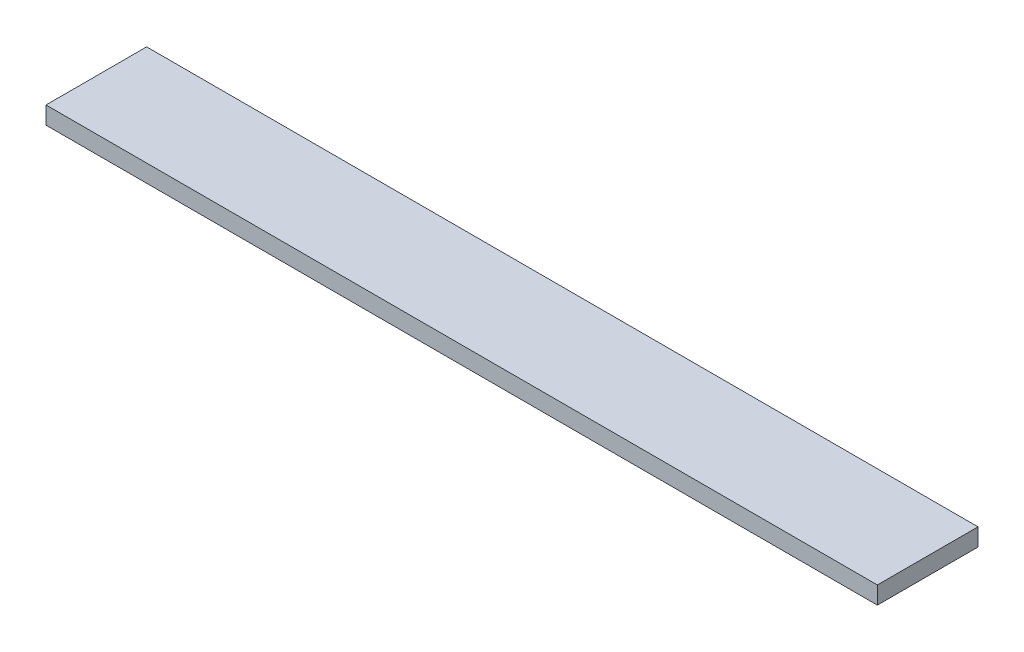
from build123d import *

# Parameters (mm, degrees)
SKETCH1_W           = 4826
SKETCH1_H           = 1168.4
BOSS_EXTRUDE1_DEPTH = 101.6
SKETCH2_W           = 4826
SKETCH2_H           = 584.2
CUT_EXTRUDE1_DEPTH  = 2485.789971004


with BuildPart() as part:
    # Sketch1 → Boss-Extrude1 (new body)
    with BuildSketch(Plane(origin=(0, 0, 0), x_dir=(1, 0, 0), z_dir=(0, 1, 0))):
        Rectangle(SKETCH1_W, SKETCH1_H)
    extrude(amount=BOSS_EXTRUDE1_DEPTH)

    # Sketch2 → Cut-Extrude1 (cut, through all)
    with BuildSketch(Plane(origin=(0, 101.6, 0), x_dir=(1, 0, 0), z_dir=(0, 1, 0))):
        with Locations((0, 292.1)):
            Rectangle(SKETCH2_W, SKETCH2_H)
    extrude(amount=-CUT_EXTRUDE1_DEPTH, mode=Mode.SUBTRACT)


solid = part.part
